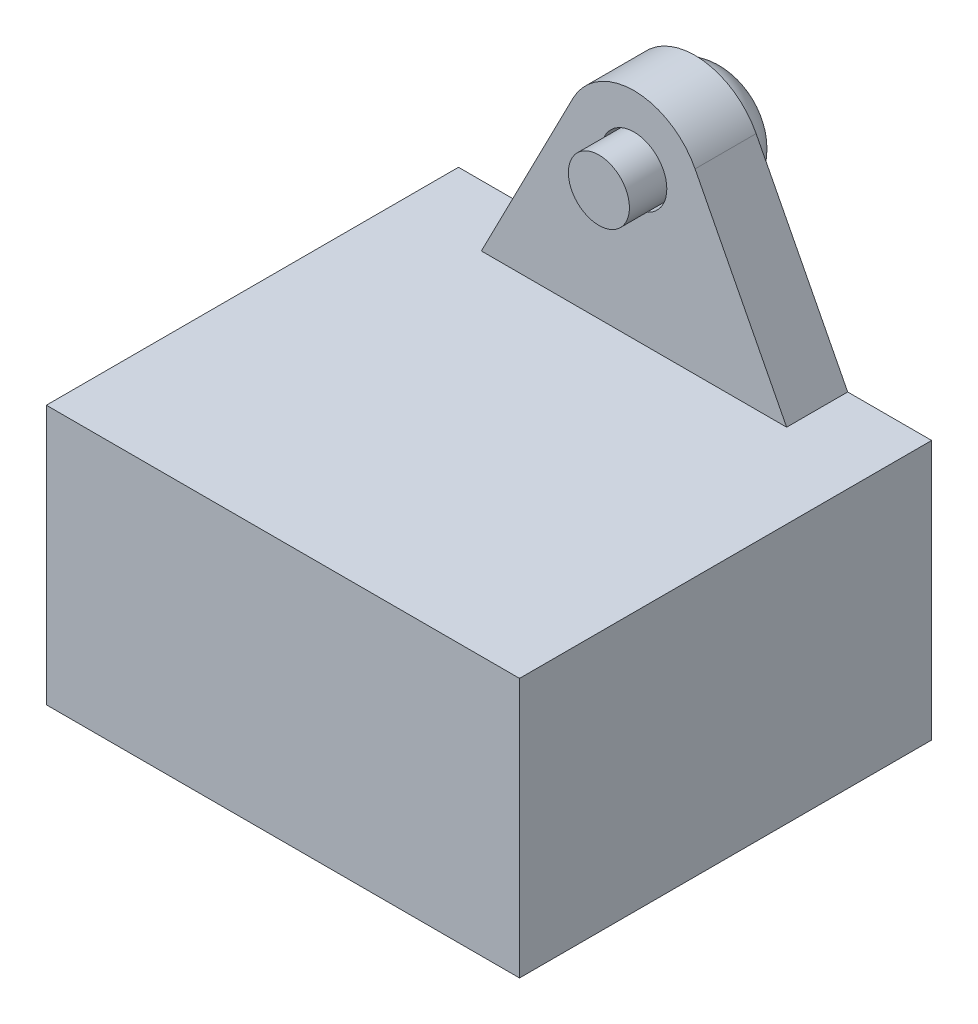
from build123d import *

# Parameters (mm, degrees)
BOSS_EXTRUDE1_DEPTH = 4
SKETCH2_W           = 31
SKETCH2_H           = 17
BOSS_EXTRUDE2_DEPTH = 27
SKETCH4_R           = 2.15
CUT_EXTRUDE1_DEPTH  = 39.429285708
CUT_EXTRUDE2_DEPTH  = 1.3


with BuildPart() as part:
    # Sketch1 → Boss-Extrude1 (new body)
    with BuildSketch(Plane.XY.offset(-4)):
        with BuildLine():
            Line((-10, -9.6), (10, -9.6))
            Line((10, -9.6), (4.001428187, 2.058779362))
            ThreePointArc((4.001428187, 2.058779362), (0, 4.5), (-4.001428187, 2.058779362))
            Line((-4.001428187, 2.058779362), (-10, -9.6))
        make_face()
    extrude(amount=BOSS_EXTRUDE1_DEPTH)

    # Sketch2 → Boss-Extrude2 (add)
    with BuildSketch(Plane.XY.offset(-4)):
        with Locations((0, -18.1)):
            Rectangle(SKETCH2_W, SKETCH2_H)
    extrude(amount=BOSS_EXTRUDE2_DEPTH)

    # Sketch4 → Cut-Extrude1 (cut, through all)
    with BuildSketch(Plane.XY):
        Circle(SKETCH4_R)
    extrude(amount=-CUT_EXTRUDE1_DEPTH, mode=Mode.SUBTRACT)

    # Sketch5 → Revolve1 (revolve)
    with BuildSketch(Plane(origin=(0, 0, 0), x_dir=(0, 0, -1), z_dir=(1, 0, 0))):
        with BuildLine():
            Line((-2.3, 0), (6.2, 0))
            Line((6.2, 0), (6.2, 1.6))
            ThreePointArc((6.2, 1.6), (5.555634919, 3.155634919), (4, 3.8))
            Line((4, 3.8), (4, 2))
            Line((4, 2), (-2.3, 2))
            Line((-2.3, 2), (-2.3, 0))
        make_face()
    revolve(axis=Axis((0, 0, 2.3), (0, 0, -1)))

    # Sketch6 → Cut-Extrude2 (cut)
    with BuildSketch(Plane.XY.offset(-6.2)):
        Polygon((0, 1.443375673), (-1.25, 0.721687836), (-1.25, -0.721687836), (0, -1.443375673), (1.25, -0.721687836), (1.25, 0.721687836), align=None)
    extrude(amount=CUT_EXTRUDE2_DEPTH, mode=Mode.SUBTRACT)


solid = part.part
